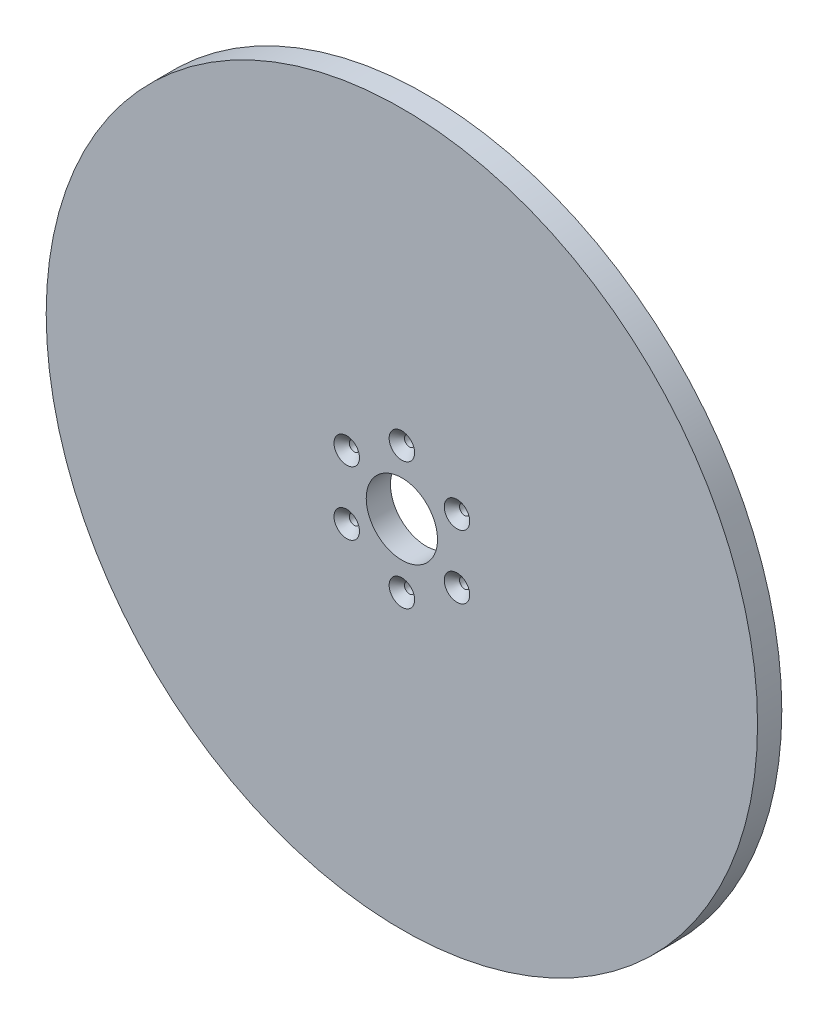
from build123d import *

# Parameters (mm, degrees)
SKETCH1_R           = 139.7
SKETCH1_R_2         = 14
BOSS_EXTRUDE1_DEPTH = 9.525
SKETCH2_R           = 2
CUT_EXTRUDE1_DEPTH  = 198.795110215
CIRPATTERN1_COUNT   = 6
CHAMFER1_SIZE       = 3


with BuildPart() as part:
    # Sketch1 → Boss-Extrude1 (new body)
    with BuildSketch(Plane.XY):
        with Locations(Location((0, 0, 0), (0, 0, 180))):
            Circle(SKETCH1_R)
        with Locations(Location((0, 0, 0), (0, 0, 180))):
            Circle(SKETCH1_R_2, mode=Mode.SUBTRACT)
    extrude(amount=BOSS_EXTRUDE1_DEPTH)

    # Sketch2 → Cut-Extrude1 (cut, through all)
    with BuildSketch(Plane.XY.offset(9.525)):
        with Locations((0, 25)):
            Circle(SKETCH2_R)
    cut_extrude1 = extrude(amount=-CUT_EXTRUDE1_DEPTH, mode=Mode.SUBTRACT)

    # CirPattern1: Cut-Extrude1 ×6 about axis
    cirpattern1_axis = Axis((0, 0, 0), (0, 0, 1))
    for i in range(1, CIRPATTERN1_COUNT):
        add(cut_extrude1.rotate(cirpattern1_axis, i * 360 / CIRPATTERN1_COUNT), mode=Mode.SUBTRACT)

    # Chamfer1
    chamfer1_edges = [part.edges().sort_by_distance(p)[0] for p in [
        (-2, 25, 9.525),
        (-22.650635095, 10.767949192, 9.525),
        (-20.650635095, -14.232050808, 9.525),
        (2, -25, 9.525),
        (22.650635095, -10.767949192, 9.525),
        (20.650635095, 14.232050808, 9.525),
    ]]
    chamfer(chamfer1_edges, length=CHAMFER1_SIZE)


solid = part.part
